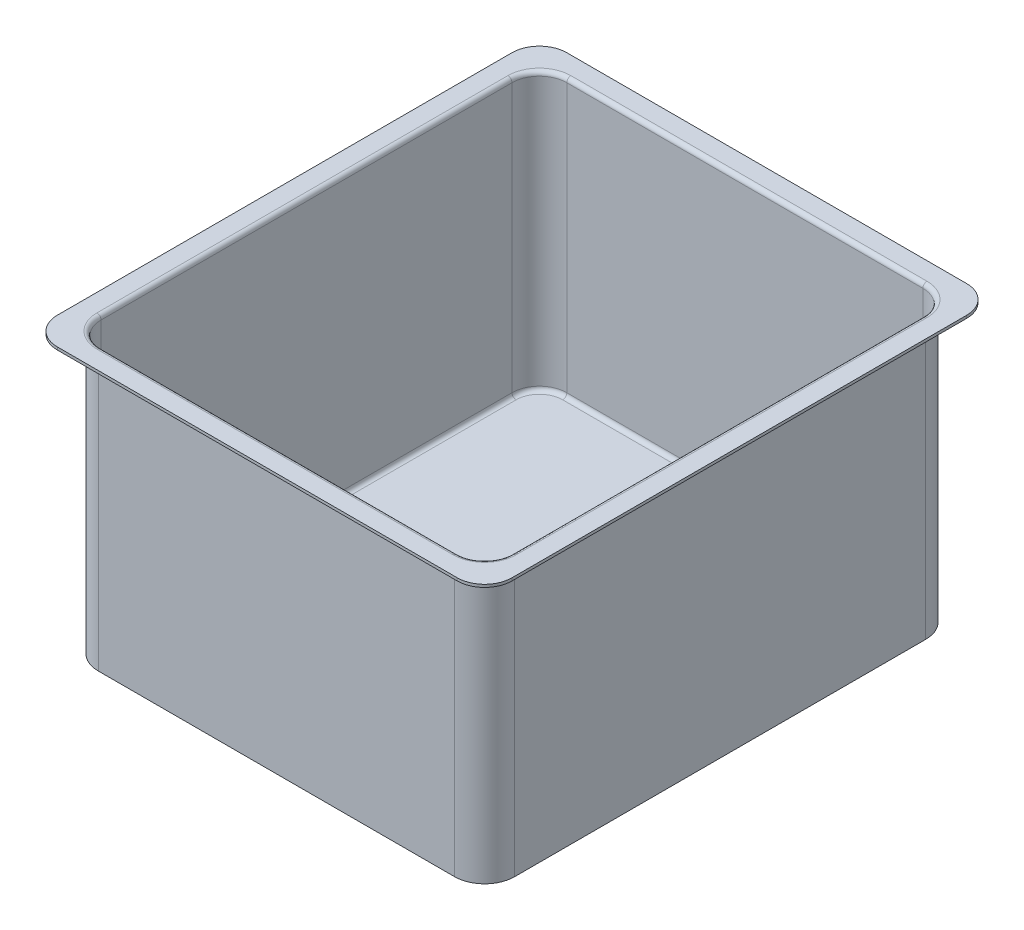
from build123d import *

# Parameters (mm, degrees)
BOSS_EXTRUDE1_DEPTH = 2
CUT_EXTRUDE1_REACH  = 251.311
BOSS_EXTRUDE2_DEPTH = 200
BOSS_EXTRUDE3_DEPTH = 2
FILLET1_R           = 3


with BuildPart() as part:
    # Sketch1 → Boss-Extrude1 (new body)
    with BuildSketch(Plane(origin=(0, 0, 0), x_dir=(1, 0, 0), z_dir=(0, 1, 0))):
        with BuildLine():
            Line((-146, 186), (146, 186))
            ThreePointArc((146, 186), (160.142135624, 180.142135624), (166, 166))
            Line((166, 166), (166, -166))
            ThreePointArc((166, -166), (160.142135624, -180.142135624), (146, -186))
            Line((146, -186), (-146, -186))
            ThreePointArc((-146, -186), (-160.142135624, -180.142135624), (-166, -166))
            Line((-166, -166), (-166, 166))
            ThreePointArc((-166, 166), (-160.142135624, 180.142135624), (-146, 186))
        make_face()
    extrude(amount=BOSS_EXTRUDE1_DEPTH)

    # Sketch2 → Cut-Extrude1 (cut, up to next)
    with BuildSketch(Plane(origin=(0, 2, 0), x_dir=(1, 0, 0), z_dir=(0, 1, 0)), mode=Mode.PRIVATE) as cut_extrude1_sk1:
        with BuildLine():
            Line((-130, 170), (130, 170))
            ThreePointArc((130, 170), (144.142135624, 164.142135624), (150, 150))
            Line((150, 150), (150, -150))
            ThreePointArc((150, -150), (144.142135624, -164.142135624), (130, -170))
            Line((130, -170), (-130, -170))
            ThreePointArc((-130, -170), (-144.142135624, -164.142135624), (-150, -150))
            Line((-150, -150), (-150, 150))
            ThreePointArc((-150, 150), (-144.142135624, 164.142135624), (-130, 170))
        make_face()
    cut_extrude1_tool1 = extrude(cut_extrude1_sk1.sketch, amount=-CUT_EXTRUDE1_REACH, mode=Mode.PRIVATE) & part.part
    add(cut_extrude1_tool1.solids().sort_by_distance((0, 2, 0))[0], mode=Mode.SUBTRACT)

    # Sketch3 → Boss-Extrude2 (add)
    with BuildSketch(Plane.XZ):
        with BuildLine():
            Line((-152, 150), (-152, -150))
            ThreePointArc((-152, -150), (-145.556349186, -165.556349186), (-130, -172))
            Line((-130, -172), (130, -172))
            ThreePointArc((130, -172), (145.556349186, -165.556349186), (152, -150))
            Line((152, -150), (152, 150))
            ThreePointArc((152, 150), (145.556349186, 165.556349186), (130, 172))
            Line((130, 172), (-130, 172))
            ThreePointArc((-130, 172), (-145.556349186, 165.556349186), (-152, 150))
        make_face()
        with BuildLine():
            Line((-130, 170), (130, 170))
            ThreePointArc((130, 170), (144.142135624, 164.142135624), (150, 150))
            Line((150, 150), (150, -150))
            ThreePointArc((150, -150), (144.142135624, -164.142135624), (130, -170))
            Line((130, -170), (-130, -170))
            ThreePointArc((-130, -170), (-144.142135624, -164.142135624), (-150, -150))
            Line((-150, -150), (-150, 150))
            ThreePointArc((-150, 150), (-144.142135624, 164.142135624), (-130, 170))
        make_face(mode=Mode.SUBTRACT)
    extrude(amount=BOSS_EXTRUDE2_DEPTH)

    # Sketch4 → Boss-Extrude3 (add)
    with BuildSketch(Plane.XZ.offset(200)):
        with BuildLine():
            Line((-130, 172), (130, 172))
            ThreePointArc((130, 172), (145.556349186, 165.556349186), (152, 150))
            Line((152, 150), (152, -150))
            ThreePointArc((152, -150), (145.556349186, -165.556349186), (130, -172))
            Line((130, -172), (-130, -172))
            ThreePointArc((-130, -172), (-145.556349186, -165.556349186), (-152, -150))
            Line((-152, -150), (-152, 150))
            ThreePointArc((-152, 150), (-145.556349186, 165.556349186), (-130, 172))
        make_face()
    extrude(amount=BOSS_EXTRUDE3_DEPTH)

    # Fillet1
    fillet1_edges = [part.edges().sort_by_distance(p)[0] for p in [
        (-144.142135624, 2, 164.142135624),
        (0, 2, 170),
        (144.142135624, 2, 164.142135624),
        (150, 2, 0),
        (144.142135624, 2, -164.142135624),
        (0, 2, -170),
        (-144.142135624, 2, -164.142135624),
        (-150, 2, 0),
        (-144.142135624, -200, -164.142135624),
        (0, -200, -170),
        (144.142135624, -200, -164.142135624),
        (150, -200, 0),
        (144.142135624, -200, 164.142135624),
        (0, -200, 170),
        (-144.142135624, -200, 164.142135624),
        (-150, -200, 0),
    ]]
    fillet(fillet1_edges, radius=FILLET1_R)


solid = part.part
